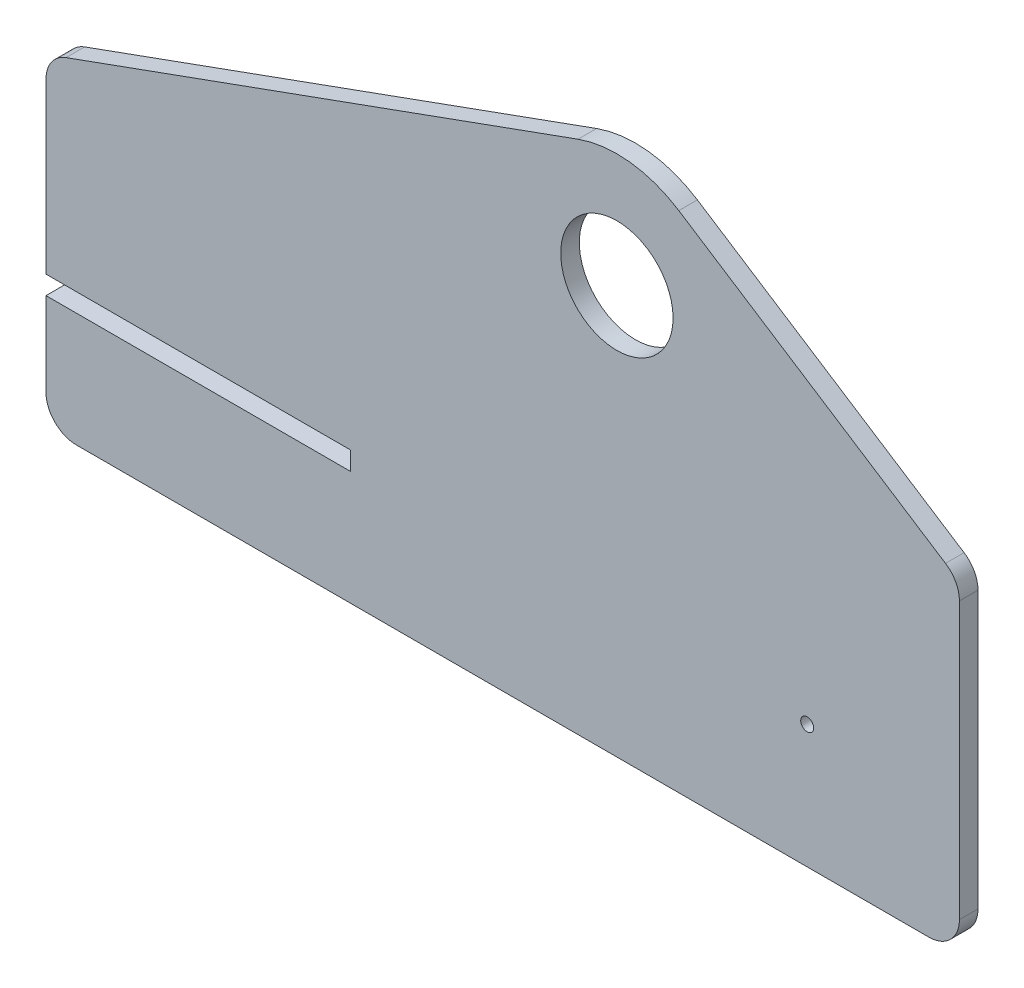
from build123d import *

# Parameters (mm, degrees)
BOSS_EXTRUDE1_DEPTH = 3.0988
SKETCH3_R           = 1.0795
SKETCH3_R_2         = 9.3726
BOSS_EXTRUDE2_DEPTH = 3.0988
FILLET1_R           = 5.08


with BuildPart() as part:
    # Sketch2 → Boss-Extrude1 (new body)
    with BuildSketch(Plane.XY):
        Polygon((-50.8, 1.5494), (-50.8, 7.8994), (50.8, 7.8994), (50.8, -7.8994), (-50.8, -7.8994), (-50.8, -1.5494), (0, -1.5494), (0, 1.5494), align=None)
    extrude(amount=BOSS_EXTRUDE1_DEPTH)

    # Sketch3 → Boss-Extrude2 (add)
    with BuildSketch(Plane.XY):
        with BuildLine():
            Line((50.8, -7.8994), (-50.8, -7.8994))
            Line((-50.8, -7.8994), (-50.8, -20.5994))
            Line((-50.8, -20.5994), (101.6, -20.5994))
            Line((101.6, -20.5994), (101.6, 33.2994))
            Line((101.6, 33.2994), (54.782161872, 63.523702231))
            ThreePointArc((54.782161872, 63.523702231), (46.597523005, 66.447615713), (37.96588061, 65.431577828))
            Line((37.96588061, 65.431577828), (-50.8, 33.2994))
            Line((-50.8, 33.2994), (-50.8, 7.8994))
            Line((-50.8, 7.8994), (50.8, 7.8994))
            Line((50.8, 7.8994), (50.8, -7.8994))
        make_face()
        with Locations((76.2, 0)):
            Circle(SKETCH3_R, mode=Mode.SUBTRACT)
        with Locations((44.45, 47.519048812)):
            Circle(SKETCH3_R_2, mode=Mode.SUBTRACT)
    extrude(amount=BOSS_EXTRUDE2_DEPTH)

    # Fillet1
    fillet1_edges = [part.edges().sort_by_distance(p)[0] for p in [
        (101.6, 33.2994, 1.5494),
        (-50.8, 33.2994, 1.5494),
        (-50.8, -20.5994, 1.5494),
        (101.6, -20.5994, 1.5494),
    ]]
    fillet(fillet1_edges, radius=FILLET1_R)


solid = part.part
